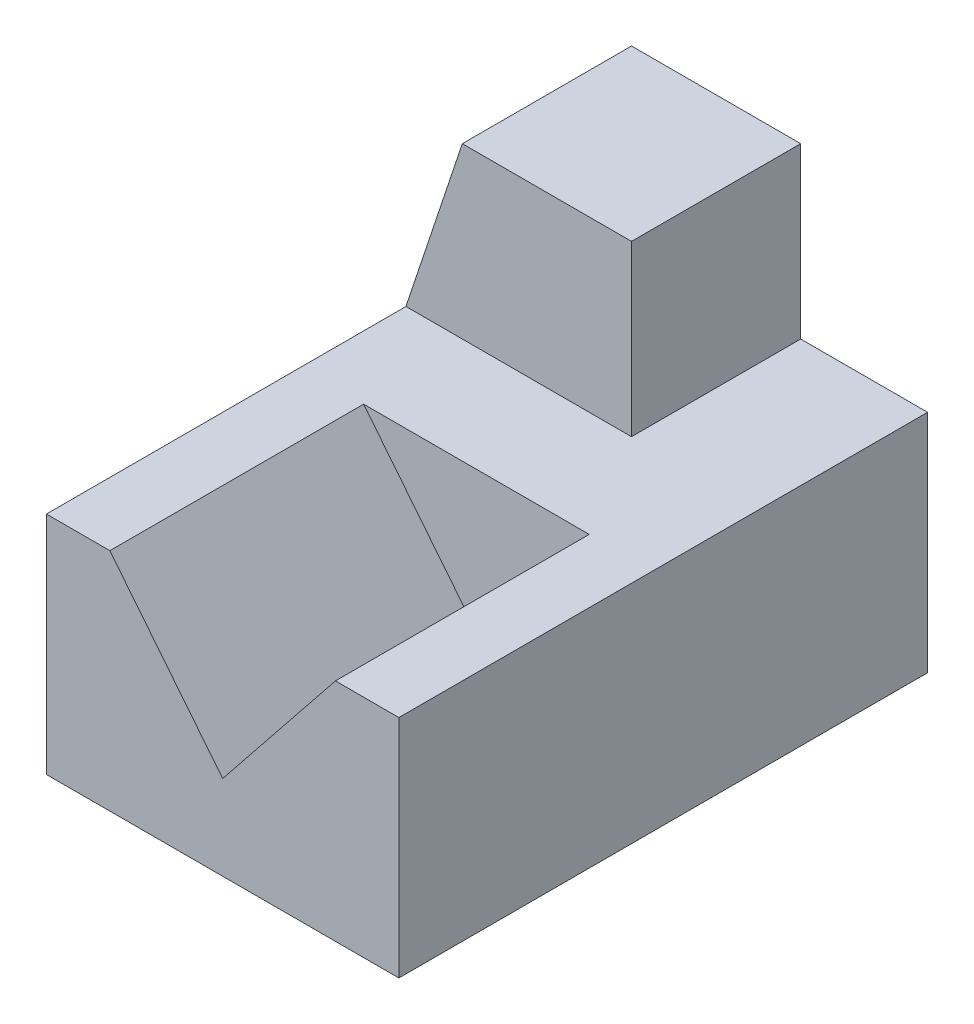
from build123d import *

# Parameters (mm, degrees)
BOSS_EXTRUDE1_DEPTH = 75
BOSS_EXTRUDE2_DEPTH = 24
CUT_EXTRUDE1_START  = 75
CUT_EXTRUDE1_DEPTH  = 36


with BuildPart() as part:
    # Sketch1 → Boss-Extrude1 (new body)
    with BuildSketch(Plane.XY):
        Polygon((25, 12), (9, 32), (0, 32), (0, 0), (50, 0), (50, 32), (41, 32), align=None)
        Polygon((32, 32), (9, 32), (25, 12), (41, 32), align=None)
    extrude(amount=BOSS_EXTRUDE1_DEPTH)

    # Sketch1<3> → Boss-Extrude2 (add)
    with BuildSketch(Plane.XY):
        Polygon((0, 32), (9, 32), (32, 32), (32, 56), (8, 56), align=None)
    extrude(amount=BOSS_EXTRUDE2_DEPTH)

    # Sketch1<4> → Cut-Extrude1 (cut)
    with BuildSketch(Plane.XY.offset(CUT_EXTRUDE1_START)):
        Polygon((32, 32), (9, 32), (25, 12), (41, 32), align=None)
    extrude(amount=-CUT_EXTRUDE1_DEPTH, mode=Mode.SUBTRACT)


solid = part.part
